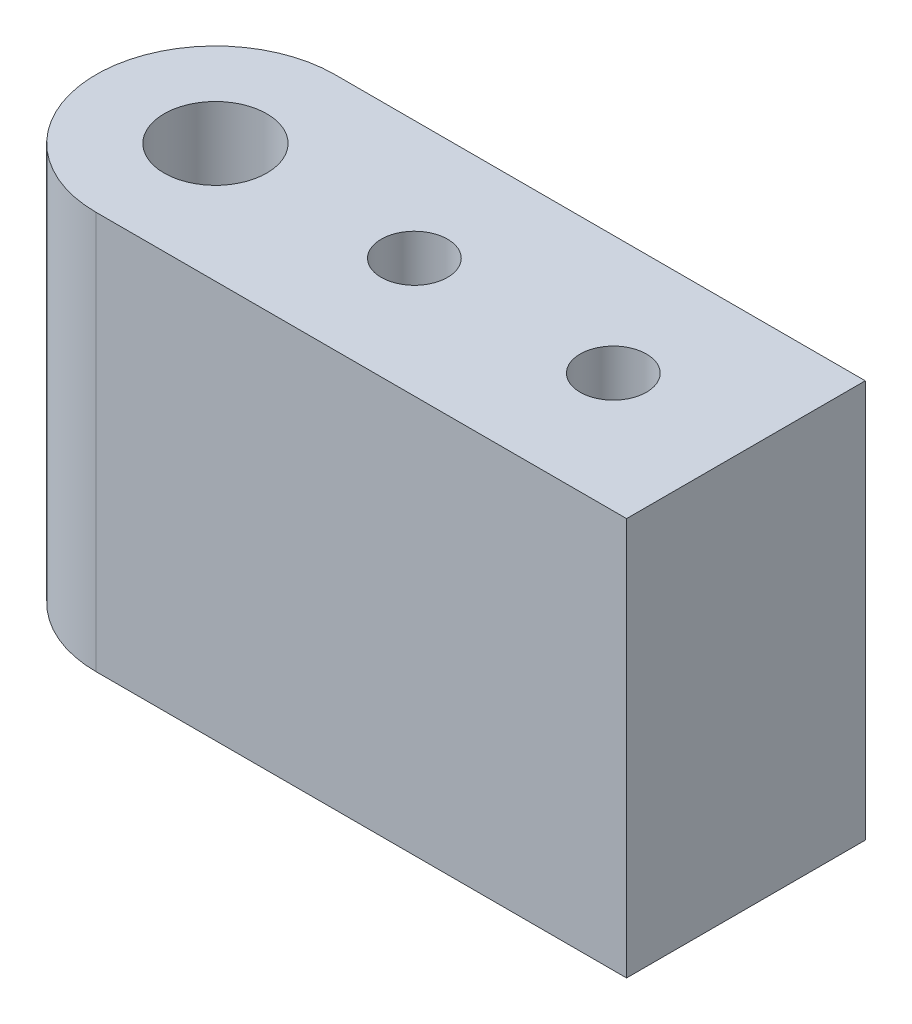
from build123d import *

# Parameters (mm, degrees)
SKETCH2_R           = 1.937236025
SKETCH2_R_2         = 1.25
BOSS_EXTRUDE2_DEPTH = 15


with BuildPart() as part:
    # Sketch2 → Boss-Extrude2 (new body)
    with BuildSketch(Plane(origin=(0, 0, 0), x_dir=(1, 0, 0), z_dir=(0, 1, 0))):
        with BuildLine():
            Line((20, 9), (0, 9))
            ThreePointArc((0, 9), (-4.5, 4.5), (0, 0))
            Line((0, 0), (20, 0))
            Line((20, 0), (20, 9))
        make_face()
        with Locations((0, 4.5)):
            Circle(SKETCH2_R, mode=Mode.SUBTRACT)
        with BuildLine():
            ThreePointArc((8.75, 4.5), (7.5, 3.25), (6.25, 4.5))
            ThreePointArc((6.25, 4.5), (7.5, 5.75), (8.75, 4.5))
        make_face(mode=Mode.SUBTRACT)
        with Locations((15, 4.5)):
            Circle(SKETCH2_R_2, mode=Mode.SUBTRACT)
    extrude(amount=BOSS_EXTRUDE2_DEPTH)


solid = part.part
